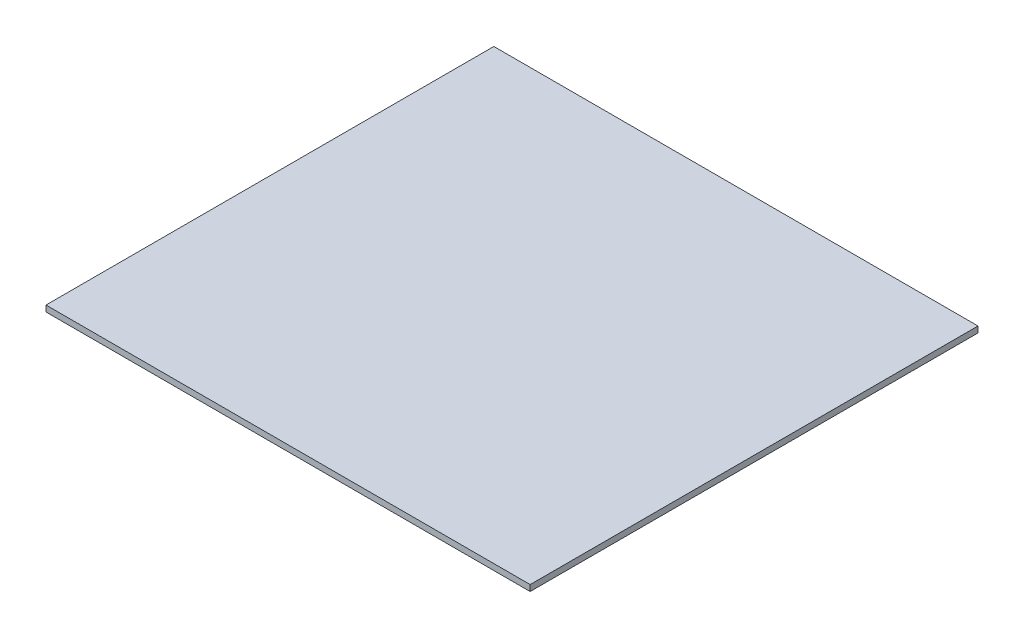
from build123d import *

# Parameters (mm, degrees)
SKETCH1_W           = 508
SKETCH1_H           = 469.9
BOSS_EXTRUDE1_DEPTH = 6.35


with BuildPart() as part:
    # Sketch1 → Boss-Extrude1 (new body)
    with BuildSketch(Plane(origin=(0, 0, 0), x_dir=(1, 0, 0), z_dir=(0, 1, 0))):
        with Locations((254, 234.95)):
            Rectangle(SKETCH1_W, SKETCH1_H)
    extrude(amount=BOSS_EXTRUDE1_DEPTH)


solid = part.part
